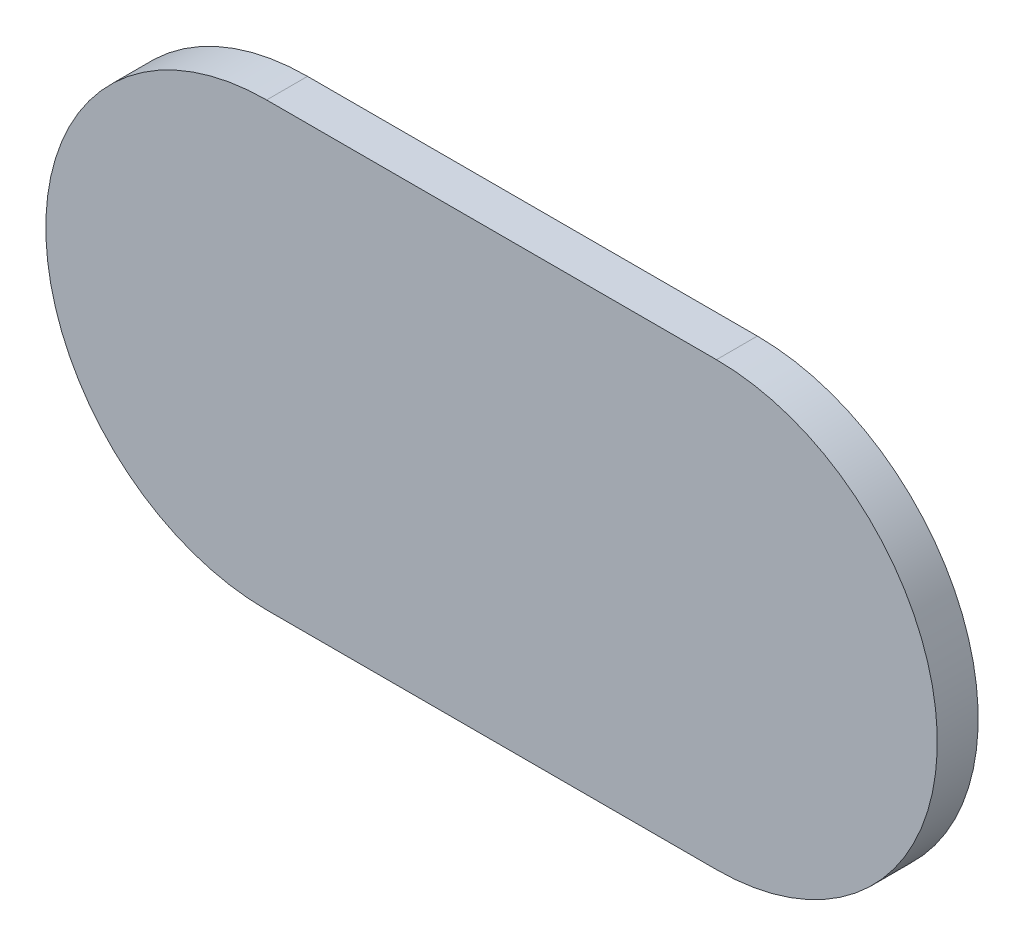
from build123d import *

# Parameters (mm, degrees)
BOSS_EXTRU_1_DEPTH = 0.5


with BuildPart() as part:
    # Esquisse1 → Boss.-Extru.1 (new body)
    with BuildSketch(Plane.XY):
        with BuildLine():
            Line((2.75, -2.7), (-2.75, -2.7))
            ThreePointArc((-2.75, -2.7), (-5.45, 0), (-2.75, 2.7))
            Line((-2.75, 2.7), (2.75, 2.7))
            ThreePointArc((2.75, 2.7), (5.45, 0), (2.75, -2.7))
        make_face()
    extrude(amount=BOSS_EXTRU_1_DEPTH)


solid = part.part
